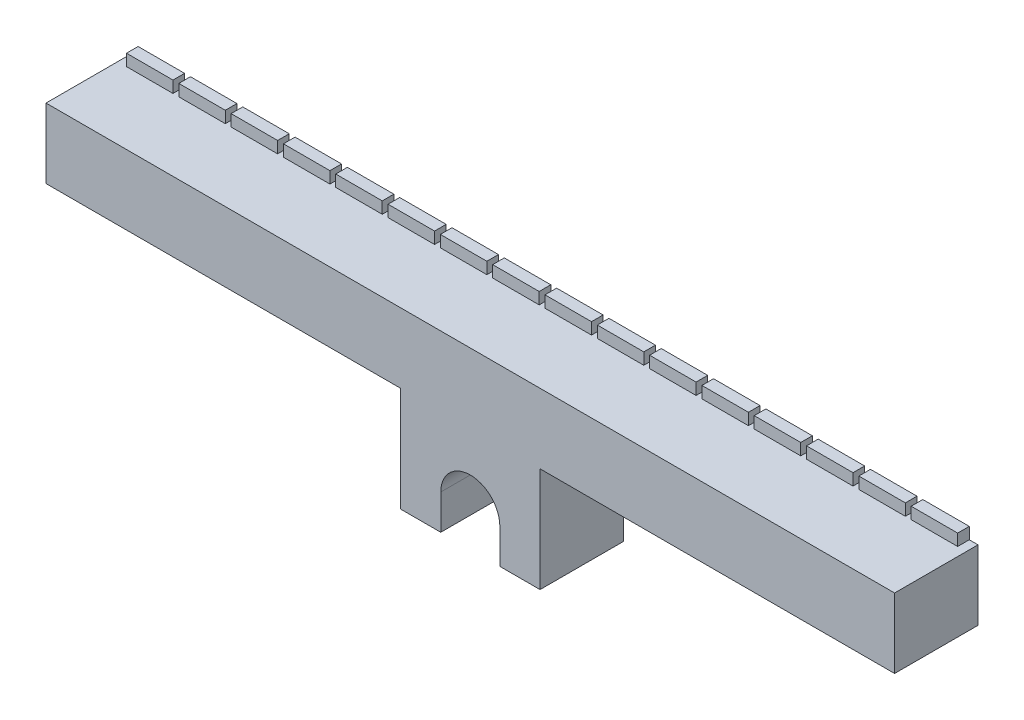
from build123d import *

# Parameters (mm, degrees)
SKETCH1_W           = 73
SKETCH1_H           = 7.175
BOSS_EXTRUDE1_DEPTH = 6
SKETCH15_W          = 4
SKETCH15_H          = 1
BOSS_EXTRUDE6_DEPTH = 1
BOSS_EXTRUDE7_START = -0.5
BOSS_EXTRUDE7_DEPTH = 7.175


with BuildPart() as part:
    # Sketch1 → Boss-Extrude1 (new body)
    with BuildSketch(Plane(origin=(0, 0, 0), x_dir=(1, 0, 0), z_dir=(0, 1, 0))):
        with Locations((0, -3.0875)):
            Rectangle(SKETCH1_W, SKETCH1_H)
    extrude(amount=BOSS_EXTRUDE1_DEPTH)

    # Sketch15 → Boss-Extrude6 (add)
    with BuildSketch(Plane(origin=(0, 6, 0), x_dir=(1, 0, 0), z_dir=(0, 1, 0))):
        with Locations((2.25, 0)):
            Rectangle(SKETCH15_W, SKETCH15_H)
        with Locations((6.75, 0)):
            Rectangle(SKETCH15_W, SKETCH15_H)
        with Locations((11.25, 0)):
            Rectangle(SKETCH15_W, SKETCH15_H)
        with Locations((15.75, 0)):
            Rectangle(SKETCH15_W, SKETCH15_H)
        with Locations((20.25, 0)):
            Rectangle(SKETCH15_W, SKETCH15_H)
        with Locations((24.75, 0)):
            Rectangle(SKETCH15_W, SKETCH15_H)
        with Locations((29.25, 0)):
            Rectangle(SKETCH15_W, SKETCH15_H)
        with Locations((33.75, 0)):
            Rectangle(SKETCH15_W, SKETCH15_H)
        with Locations((-33.75, 0)):
            Rectangle(SKETCH15_W, SKETCH15_H)
        with Locations((-29.25, 0)):
            Rectangle(SKETCH15_W, SKETCH15_H)
        with Locations((-24.75, 0)):
            Rectangle(SKETCH15_W, SKETCH15_H)
        with Locations((-20.25, 0)):
            Rectangle(SKETCH15_W, SKETCH15_H)
        with Locations((-15.75, 0)):
            Rectangle(SKETCH15_W, SKETCH15_H)
        with Locations((-11.25, 0)):
            Rectangle(SKETCH15_W, SKETCH15_H)
        with Locations((-6.75, 0)):
            Rectangle(SKETCH15_W, SKETCH15_H)
        with Locations((-2.25, 0)):
            Rectangle(SKETCH15_W, SKETCH15_H)
    extrude(amount=BOSS_EXTRUDE6_DEPTH)

    # Sketch16 → Boss-Extrude7 (add)
    with BuildSketch(Plane.XY.offset(BOSS_EXTRUDE7_START)):
        with BuildLine():
            Line((-2.54, -6), (-2.54, -9))
            Line((-2.54, -9), (-6, -9))
            Line((-6, -9), (-6, 0))
            Line((-6, 0), (6, 0))
            Line((6, 0), (6, -9))
            Line((6, -9), (2.54, -9))
            Line((2.54, -9), (2.54, -6))
            ThreePointArc((2.54, -6), (0, -3.46), (-2.54, -6))
        make_face()
    extrude(amount=BOSS_EXTRUDE7_DEPTH)


solid = part.part
